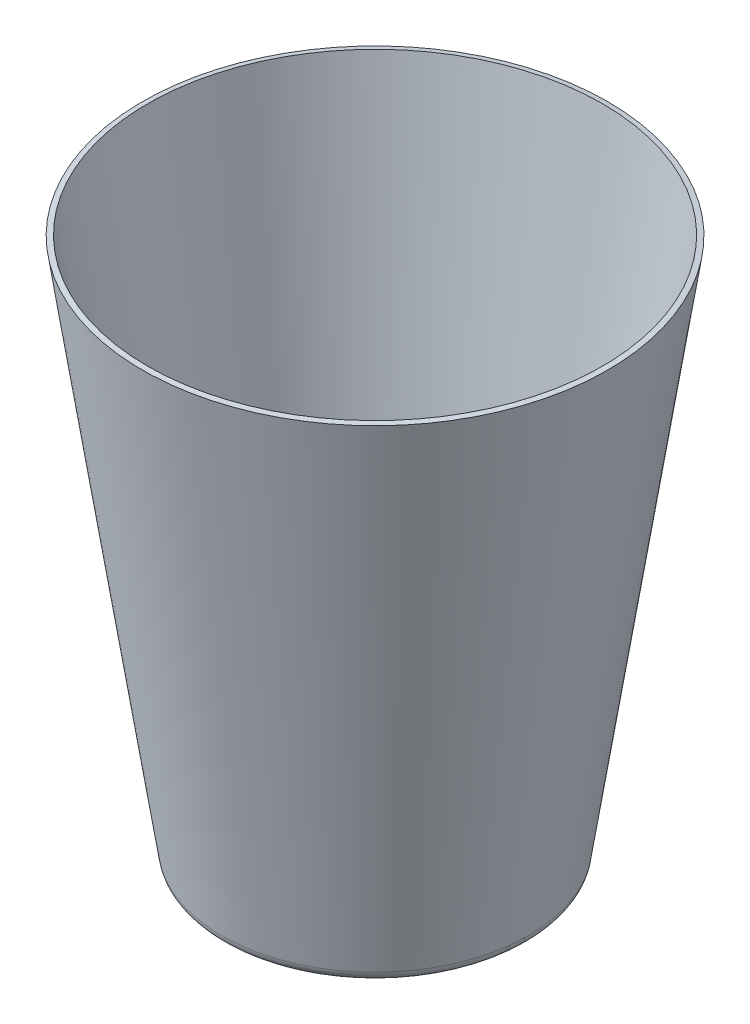
from build123d import *


with BuildPart() as part:
    # Sketch1 → Revolve-Thin1 (revolve)
    with BuildSketch(Plane.XY, mode=Mode.PRIVATE) as revolve_thin1_sk:
        with BuildLine():
            Line((0, 0), (21.427108912, 0))
            ThreePointArc((21.427108912, 0), (22.732446148, 0.484712997), (23.40506946, 1.7039053))
            Line((23.40506946, 1.7039053), (35.5, 82.5))
            Line((35.5, 82.5), (34.708815781, 82.61843788))
            Line((34.708815781, 82.61843788), (22.613885241, 1.82234318))
            ThreePointArc((22.613885241, 1.82234318), (22.210311254, 1.090827798), (21.427108912, 0.8))
            Line((21.427108912, 0.8), (0, 0.8))
            Line((0, 0.8), (0, 0))
        make_face()
    revolve(revolve_thin1_sk.sketch.rotate(Axis((0, 0, 0), (0, 1, 0)), 90), axis=Axis((0, 0, 0), (0, 1, 0)))


solid = part.part
